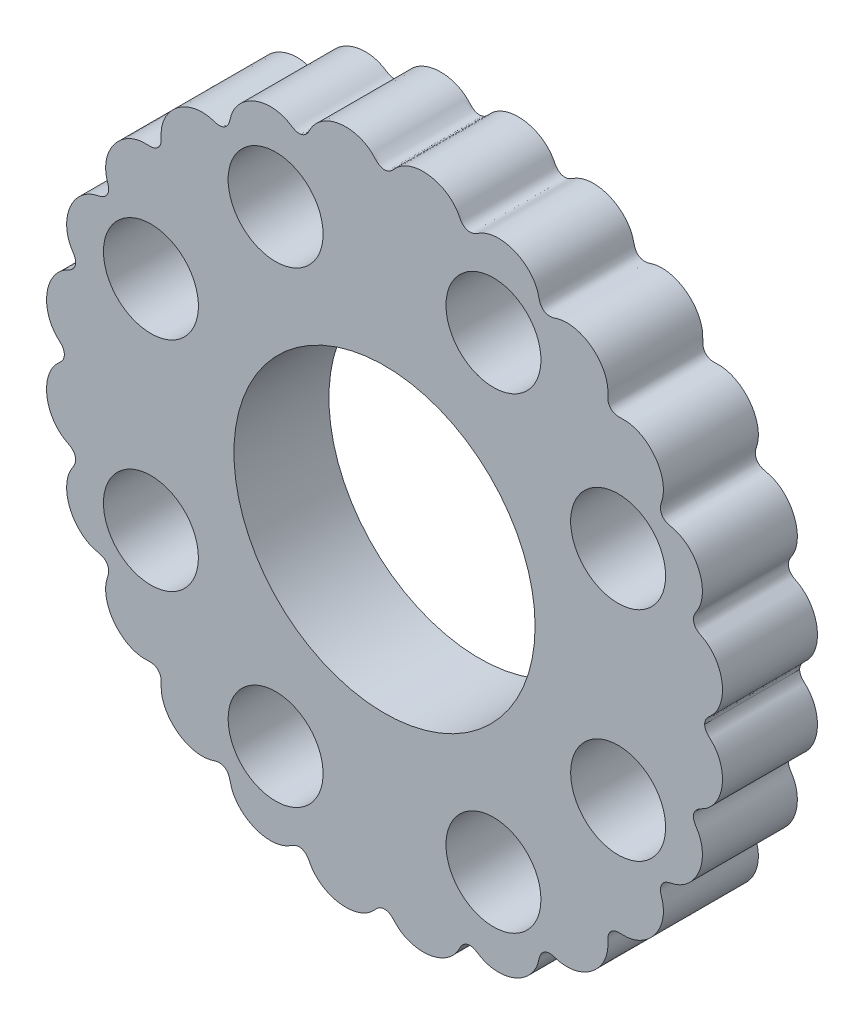
from build123d import *

# Parameters (mm, degrees)
BOSS_EXTRU_1_DEPTH      = 7
ESQUISSE2_R             = 3.5
ESQUISSE2_R_2           = 11.1
ENL_V_MAT_EXTRU_1_DEPTH = 36.920734554


with BuildPart() as part:
    # Esquisse1 → Boss.-Extru.1 (new body)
    with BuildSketch(Plane.XY):
        with BuildLine():
            add(Edge.make_bspline(
                [(23.6, 0), (23.6, 0.141263317), (23.694957489, 0.436529968), (23.984105148, 0.699966416), (24.214098656, 0.92210788), (24.485922993, 1.265914284), (24.738195558, 1.753151116), (24.902804155, 2.39533748), (24.929061691, 3.058471588), (24.820146126, 3.713569854), (24.57955061, 4.33187121), (24.214467979, 4.883674944), (23.809838813, 5.256722709), (23.444567676, 5.486205657), (23.121830867, 5.632182108), (22.805829464, 5.950444407), (22.734313606, 6.404992853), (22.914932417, 6.792042139), (23.100388311, 7.061569454), (23.241322807, 7.357836955), (23.379653116, 7.771179165), (23.455167998, 8.317175234), (23.400481311, 8.977844215), (23.210210839, 9.613984821), (22.894930523, 10.198352072), (22.466428325, 10.704182585), (22.026991864, 11.036841208), (21.636830993, 11.231351768), (21.327761788, 11.341047304), (21.006646284, 11.400550336), (20.604652425, 11.546398108), (20.33360552, 11.919233538), (20.332098964, 12.366005113), (20.45722004, 12.699209104), (20.553070598, 13.118610088), (20.575521706, 13.669103022), (20.443453625, 14.317226653), (20.176384255, 14.92460977), (19.790172286, 15.464839232), (19.30269971, 15.915187436), (18.732196788, 16.252890186), (18.209304306, 16.419015566), (17.773926091, 16.469947133), (17.454880581, 16.46414596), (17.062370957, 16.447336106), (16.654155245, 16.654181217), (16.447354302, 17.062303221), (16.463995345, 17.454871193), (16.47000351, 17.773792082), (16.418987054, 18.209391085), (16.252899593, 18.732164041), (15.915186599, 19.302700185), (15.464853958, 19.790162793), (14.924615452, 20.176378936), (14.317280714, 20.443456307), (13.668954873, 20.575502528), (13.119018963, 20.55312993), (12.698551766, 20.457182646), (12.366975365, 20.332173557), (11.918544843, 20.333761346), (11.546613574, 20.604610058), (11.40064872, 21.005766845), (11.341293082, 21.327714877), (11.231226117, 21.63694), (11.036938401, 22.026913374), (10.704156075, 22.466459205), (10.198341832, 22.894933668), (9.613976893, 23.210215116), (8.977833581, 23.400481614), (8.317182897, 23.455167864), (7.771097903, 23.379662569), (7.357907338, 23.241306143), (7.061498599, 23.100444819), (6.791854452, 22.914860356), (6.404942564, 22.734347878), (5.950451983, 22.805835984), (5.632237823, 23.121749776), (5.486345168, 23.444347145), (5.256676854, 23.809987802), (4.883690774, 24.214428605), (4.331849996, 24.5795686), (3.713564416, 24.820144223), (3.058466294, 24.929064174), (2.395320656, 24.902799203), (1.753142261, 24.73820842), (1.265895934, 24.485857583), (0.922135884, 24.214172246), (0.700203774, 23.984231078), (0.434473803, 23.694819976), (5.2772e-05, 23.552557421), (-0.434333113, 23.694820917), (-0.701425566, 23.984569), (-0.921337471, 24.213735069), (-1.266478689, 24.486196796), (-1.752999049, 24.738117012), (-2.395391205, 24.902832375), (-3.058454415, 24.929057732), (-3.713563151, 24.82014516), (-4.331853239, 24.579567427), (-4.883691331, 24.214428226), (-5.256677903, 23.809987443), (-5.4863451, 23.44434672), (-5.632237756, 23.12174991), (-5.950451972, 22.805835957), (-6.404942594, 22.734347884), (-6.791854452, 22.914860344), (-7.061498587, 23.100444822), (-7.357907347, 23.241306142), (-7.771097896, 23.37966257), (-8.317182899, 23.455167864), (-8.977833581, 23.400481614), (-9.613976894, 23.210215116), (-10.198341833, 22.894933668), (-10.704156075, 22.466459205), (-11.036938403, 22.026913373), (-11.231226116, 21.636940001), (-11.341293084, 21.327714875), (-11.400648718, 21.005766845), (-11.546613572, 20.60461006), (-11.918544844, 20.333761347), (-12.366975388, 20.332173538), (-12.698551664, 20.457182667), (-13.119019113, 20.553129909), (-13.668955007, 20.575502444), (-14.31728076, 20.443456275), (-14.924615464, 20.176378324), (-15.46485336, 19.790164133), (-15.915186091, 19.302700475), (-16.252900044, 18.732163975), (-16.418987453, 18.209390893), (-16.470003235, 17.773792163), (-16.463995514, 17.454871292), (-16.447354283, 17.062303151), (-16.654155252, 16.654181231), (-17.062370949, 16.447336105), (-17.454880537, 16.464145974), (-17.773926212, 16.469947179), (-18.209304238, 16.419015446), (-18.732196855, 16.252890081), (-19.302699499, 15.915187249), (-19.790172128, 15.464840391), (-20.1763834, 14.924609485), (-20.443455016, 14.317235113), (-20.575514472, 13.669078012), (-20.553095691, 13.118679577), (-20.457194791, 12.699092672), (-20.332084532, 12.366199531), (-20.33370059, 11.918980241), (-20.604412947, 11.54678832), (-21.006064592, 11.400694901), (-21.327826085, 11.341205229), (-21.636901956, 11.231235101), (-22.026915175, 11.03694368), (-22.46644734, 10.70416594), (-22.894929089, 10.198350592), (-23.210211743, 9.613983535), (-23.400479411, 8.977847773), (-23.455168277, 8.317175145), (-23.379653689, 7.771179811), (-23.241322407, 7.357836312), (-23.10038839, 7.061570012), (-22.914932508, 6.79204212), (-22.734313593, 6.404992849), (-22.805829472, 5.9504444), (-23.121830856, 5.632182119), (-23.444567687, 5.486205649), (-23.809838801, 5.256722717), (-24.214467983, 4.88367495), (-24.57955057, 4.331871224), (-24.820146163, 3.713569956), (-24.929061366, 3.058471564), (-24.90280557, 2.395337789), (-24.738191624, 1.753148162), (-24.485935157, 1.265916949), (-24.21407506, 0.922091043), (-23.984176287, 0.70007175), (-23.694816972, 0.436329885), (-23.6, 0.141221691), (-23.6, 0)],
                knots=[0.075303121, 0.075303121, 0.075303121, 0.075303121, 0.078621066, 0.081939011, 0.085256955, 0.0885749, 0.095210789, 0.101846679, 0.108482568, 0.115118457, 0.121754346, 0.128390236, 0.135026125, 0.13834407, 0.141662014, 0.144979959, 0.148297904, 0.151615848, 0.154933793, 0.158251737, 0.161569682, 0.168205571, 0.174841461, 0.18147735, 0.188113239, 0.194749129, 0.201385018, 0.204702962, 0.208020907, 0.211338852, 0.214656796, 0.217974741, 0.221292686, 0.22461063, 0.227928575, 0.234564464, 0.241200354, 0.247836243, 0.254472132, 0.261108021, 0.267743911, 0.2743798, 0.277697745, 0.281015689, 0.284333634, 0.287651579, 0.290969523, 0.294287468, 0.297605412, 0.300923357, 0.307559246, 0.314195136, 0.320831025, 0.327466914, 0.334102804, 0.340738693, 0.347374582, 0.350692527, 0.354010471, 0.357328416, 0.360646361, 0.363964305, 0.36728225, 0.370600195, 0.373918139, 0.380554029, 0.387189918, 0.393825807, 0.400461696, 0.407097586, 0.413733475, 0.41705142, 0.420369364, 0.423687309, 0.427005254, 0.430323198, 0.433641143, 0.436959087, 0.440277032, 0.446912921, 0.453548811, 0.4601847, 0.466820589, 0.473456478, 0.480092368, 0.486728257, 0.490046202, 0.493364146, 0.496682091, 0.500000036, 0.50331798, 0.506635925, 0.50995387, 0.513271814, 0.519907703, 0.526543593, 0.533179482, 0.539815371, 0.546451261, 0.55308715, 0.559723039, 0.563040984, 0.566358928, 0.569676873, 0.572994818, 0.576312762, 0.579630707, 0.582948652, 0.586266596, 0.592902486, 0.599538375, 0.606174264, 0.612810153, 0.619446043, 0.626081932, 0.629399877, 0.632717821, 0.636035766, 0.639353711, 0.642671655, 0.6459896, 0.649307545, 0.652625489, 0.659261378, 0.665897268, 0.672533157, 0.679169046, 0.685804936, 0.692440825, 0.699076714, 0.702394659, 0.705712603, 0.709030548, 0.712348493, 0.715666437, 0.718984382, 0.722302327, 0.725620271, 0.732256161, 0.73889205, 0.745527939, 0.752163828, 0.758799718, 0.765435607, 0.772071496, 0.775389441, 0.778707386, 0.78202533, 0.785343275, 0.78866122, 0.791979164, 0.795297109, 0.798615053, 0.805250943, 0.811886832, 0.818522721, 0.825158611, 0.8317945, 0.838430389, 0.841748334, 0.845066278, 0.848384223, 0.851702168, 0.855020112, 0.858338057, 0.861656002, 0.864973946, 0.871609836, 0.878245725, 0.884881614, 0.891517503, 0.898153393, 0.904789282, 0.911425171, 0.914743116, 0.918061061, 0.921379005, 0.92469695, 0.92469695, 0.92469695, 0.92469695], degree=3))
            add(Edge.make_bspline(
                [(-23.6, 0), (-23.6, -0.141221691), (-23.694816972, -0.436329885), (-23.984176287, -0.70007175), (-24.21407506, -0.922091043), (-24.485935157, -1.265916949), (-24.738191624, -1.753148162), (-24.90280557, -2.395337789), (-24.929061366, -3.058471564), (-24.820146163, -3.713569956), (-24.57955057, -4.331871224), (-24.214467983, -4.88367495), (-23.809838801, -5.256722717), (-23.444567687, -5.486205649), (-23.121830856, -5.632182119), (-22.805829472, -5.9504444), (-22.734313593, -6.404992849), (-22.914932508, -6.79204212), (-23.10038839, -7.061570012), (-23.241322407, -7.357836312), (-23.379653689, -7.771179811), (-23.455168277, -8.317175145), (-23.400479411, -8.977847773), (-23.210211743, -9.613983535), (-22.894929089, -10.198350592), (-22.46644734, -10.70416594), (-22.026915175, -11.03694368), (-21.636901956, -11.231235101), (-21.327826085, -11.341205229), (-21.006064592, -11.400694901), (-20.604412947, -11.54678832), (-20.33370059, -11.918980241), (-20.332084532, -12.366199531), (-20.457194791, -12.699092672), (-20.553095691, -13.118679577), (-20.575514472, -13.669078012), (-20.443455016, -14.317235113), (-20.1763834, -14.924609485), (-19.790172128, -15.464840391), (-19.302699499, -15.915187249), (-18.732196855, -16.252890081), (-18.209304238, -16.419015446), (-17.773926212, -16.469947179), (-17.454880537, -16.464145974), (-17.062370949, -16.447336105), (-16.654155252, -16.654181231), (-16.447354283, -17.062303151), (-16.463995514, -17.454871292), (-16.470003235, -17.773792163), (-16.418987453, -18.209390893), (-16.252900044, -18.732163975), (-15.915186091, -19.302700475), (-15.46485336, -19.790164133), (-14.924615464, -20.176378324), (-14.31728076, -20.443456275), (-13.668955007, -20.575502444), (-13.119019113, -20.553129909), (-12.698551664, -20.457182667), (-12.366975388, -20.332173538), (-11.918544844, -20.333761347), (-11.546613572, -20.60461006), (-11.400648718, -21.005766845), (-11.341293084, -21.327714875), (-11.231226116, -21.636940001), (-11.036938403, -22.026913373), (-10.704156075, -22.466459205), (-10.198341833, -22.894933668), (-9.613976894, -23.210215116), (-8.977833581, -23.400481614), (-8.317182899, -23.455167864), (-7.771097896, -23.37966257), (-7.357907347, -23.241306142), (-7.061498587, -23.100444822), (-6.791854452, -22.914860344), (-6.404942594, -22.734347884), (-5.950451972, -22.805835957), (-5.632237756, -23.12174991), (-5.4863451, -23.44434672), (-5.256677903, -23.809987443), (-4.883691331, -24.214428226), (-4.331853239, -24.579567427), (-3.713563151, -24.82014516), (-3.058454415, -24.929057732), (-2.395391205, -24.902832375), (-1.752999049, -24.738117012), (-1.266478689, -24.486196796), (-0.921337471, -24.213735069), (-0.701425566, -23.984569), (-0.434333113, -23.694820917), (5.2772e-05, -23.552557421), (0.434473803, -23.694819976), (0.700203774, -23.984231078), (0.922135884, -24.214172246), (1.265895934, -24.485857583), (1.753142261, -24.73820842), (2.395320656, -24.902799203), (3.058466294, -24.929064174), (3.713564416, -24.820144223), (4.331849996, -24.5795686), (4.883690774, -24.214428605), (5.256676854, -23.809987802), (5.486345168, -23.444347145), (5.632237823, -23.121749776), (5.950451983, -22.805835984), (6.404942564, -22.734347878), (6.791854452, -22.914860356), (7.061498599, -23.100444819), (7.357907338, -23.241306143), (7.771097903, -23.379662569), (8.317182897, -23.455167864), (8.977833581, -23.400481614), (9.613976893, -23.210215116), (10.198341832, -22.894933668), (10.704156075, -22.466459205), (11.036938401, -22.026913374), (11.231226117, -21.63694), (11.341293082, -21.327714877), (11.40064872, -21.005766845), (11.546613574, -20.604610058), (11.918544843, -20.333761346), (12.366975365, -20.332173557), (12.698551766, -20.457182646), (13.119018963, -20.55312993), (13.668954873, -20.575502528), (14.317280714, -20.443456307), (14.924615452, -20.176378936), (15.464853958, -19.790162793), (15.915186599, -19.302700185), (16.252899593, -18.732164041), (16.418987054, -18.209391085), (16.47000351, -17.773792082), (16.463995345, -17.454871193), (16.447354302, -17.062303221), (16.654155245, -16.654181217), (17.062370957, -16.447336106), (17.454880581, -16.46414596), (17.773926091, -16.469947133), (18.209304306, -16.419015566), (18.732196788, -16.252890186), (19.30269971, -15.915187436), (19.790172286, -15.464839232), (20.176384255, -14.92460977), (20.443453625, -14.317226653), (20.575521706, -13.669103022), (20.553070598, -13.118610088), (20.45722004, -12.699209104), (20.332098964, -12.366005113), (20.33360552, -11.919233538), (20.604652425, -11.546398108), (21.006646284, -11.400550336), (21.327761788, -11.341047304), (21.636830993, -11.231351768), (22.026991864, -11.036841208), (22.466428325, -10.704182585), (22.894930523, -10.198352072), (23.210210839, -9.613984821), (23.400481311, -8.977844215), (23.455167998, -8.317175234), (23.379653116, -7.771179165), (23.241322807, -7.357836955), (23.100388311, -7.061569454), (22.914932417, -6.792042139), (22.734313606, -6.404992853), (22.805829464, -5.950444407), (23.121830867, -5.632182108), (23.444567676, -5.486205657), (23.809838813, -5.256722709), (24.214467979, -4.883674944), (24.57955061, -4.33187121), (24.820146126, -3.713569854), (24.929061691, -3.058471588), (24.902804155, -2.39533748), (24.738195558, -1.753151116), (24.485922993, -1.265914284), (24.214098656, -0.92210788), (23.984105148, -0.699966416), (23.694957489, -0.436529968), (23.6, -0.141263317), (23.6, 0)],
                knots=[0.075303121, 0.075303121, 0.075303121, 0.075303121, 0.078621066, 0.081939011, 0.085256955, 0.0885749, 0.095210789, 0.101846679, 0.108482568, 0.115118457, 0.121754346, 0.128390236, 0.135026125, 0.13834407, 0.141662014, 0.144979959, 0.148297904, 0.151615848, 0.154933793, 0.158251737, 0.161569682, 0.168205571, 0.174841461, 0.18147735, 0.188113239, 0.194749129, 0.201385018, 0.204702962, 0.208020907, 0.211338852, 0.214656796, 0.217974741, 0.221292686, 0.22461063, 0.227928575, 0.234564464, 0.241200354, 0.247836243, 0.254472132, 0.261108021, 0.267743911, 0.2743798, 0.277697745, 0.281015689, 0.284333634, 0.287651579, 0.290969523, 0.294287468, 0.297605412, 0.300923357, 0.307559246, 0.314195136, 0.320831025, 0.327466914, 0.334102804, 0.340738693, 0.347374582, 0.350692527, 0.354010471, 0.357328416, 0.360646361, 0.363964305, 0.36728225, 0.370600195, 0.373918139, 0.380554029, 0.387189918, 0.393825807, 0.400461696, 0.407097586, 0.413733475, 0.41705142, 0.420369364, 0.423687309, 0.427005254, 0.430323198, 0.433641143, 0.436959087, 0.440277032, 0.446912921, 0.453548811, 0.4601847, 0.466820589, 0.473456478, 0.480092368, 0.486728257, 0.490046202, 0.493364146, 0.496682091, 0.500000036, 0.50331798, 0.506635925, 0.50995387, 0.513271814, 0.519907703, 0.526543593, 0.533179482, 0.539815371, 0.546451261, 0.55308715, 0.559723039, 0.563040984, 0.566358928, 0.569676873, 0.572994818, 0.576312762, 0.579630707, 0.582948652, 0.586266596, 0.592902486, 0.599538375, 0.606174264, 0.612810153, 0.619446043, 0.626081932, 0.629399877, 0.632717821, 0.636035766, 0.639353711, 0.642671655, 0.6459896, 0.649307545, 0.652625489, 0.659261378, 0.665897268, 0.672533157, 0.679169046, 0.685804936, 0.692440825, 0.699076714, 0.702394659, 0.705712603, 0.709030548, 0.712348493, 0.715666437, 0.718984382, 0.722302327, 0.725620271, 0.732256161, 0.73889205, 0.745527939, 0.752163828, 0.758799718, 0.765435607, 0.772071496, 0.775389441, 0.778707386, 0.78202533, 0.785343275, 0.78866122, 0.791979164, 0.795297109, 0.798615053, 0.805250943, 0.811886832, 0.818522721, 0.825158611, 0.8317945, 0.838430389, 0.841748334, 0.845066278, 0.848384223, 0.851702168, 0.855020112, 0.858338057, 0.861656002, 0.864973946, 0.871609836, 0.878245725, 0.884881614, 0.891517503, 0.898153393, 0.904789282, 0.911425171, 0.914743116, 0.918061061, 0.921379005, 0.92469695, 0.92469695, 0.92469695, 0.92469695], degree=3))
        make_face()
    extrude(amount=BOSS_EXTRU_1_DEPTH)

    # Esquisse2 → Enlèv. mat.-Extru.1 (cut, through all)
    with BuildSketch(Plane.XY.offset(7)):
        with Locations((-8.029746973, 17.219847954)):
            Circle(ESQUISSE2_R)
        with Locations(Location((8.029746973, 17.219847954, 0), (0, 0, 180))):
            Circle(ESQUISSE2_R)
        with Locations((17.219847954, 8.029746973)):
            Circle(ESQUISSE2_R)
        with Locations(Location((17.219847954, -8.029746973, 0), (0, 0, 180))):
            Circle(ESQUISSE2_R)
        with Locations((8.029746973, -17.219847954)):
            Circle(ESQUISSE2_R)
        with Locations(Location((-8.029746973, -17.219847954, 0), (0, 0, 180))):
            Circle(ESQUISSE2_R)
        with Locations((-17.219847954, -8.029746973)):
            Circle(ESQUISSE2_R)
        with Locations(Location((-17.219847954, 8.029746973, 0), (0, 0, 180))):
            Circle(ESQUISSE2_R)
        Circle(ESQUISSE2_R_2)
    extrude(amount=-ENL_V_MAT_EXTRU_1_DEPTH, mode=Mode.SUBTRACT)


solid = part.part
